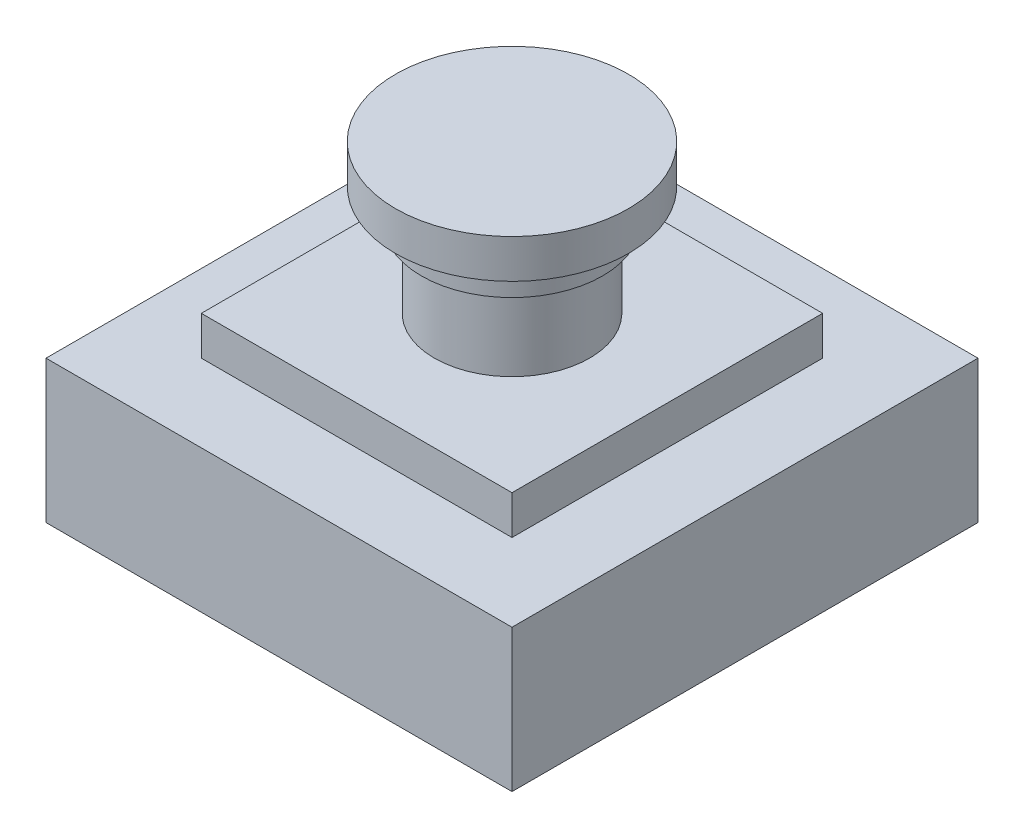
from build123d import *

# Parameters (mm, degrees)
SKETCH1_W           = 36
SKETCH1_H           = 36
BOSS_EXTRUDE1_DEPTH = 11
SKETCH2_W           = 24
SKETCH2_H           = 24
BOSS_EXTRUDE2_DEPTH = 3
SKETCH3_R           = 6
BOSS_EXTRUDE3_DEPTH = 6
SKETCH4_R           = 7
BOSS_EXTRUDE4_DEPTH = 2.5
SKETCH5_R           = 9
BOSS_EXTRUDE5_DEPTH = 3


with BuildPart() as part:
    # Sketch1 → Boss-Extrude1 (new body)
    with BuildSketch(Plane(origin=(0, 0, 0), x_dir=(1, 0, 0), z_dir=(0, 1, 0))):
        Rectangle(SKETCH1_W, SKETCH1_H)
    extrude(amount=BOSS_EXTRUDE1_DEPTH)

    # Sketch2 → Boss-Extrude2 (add)
    with BuildSketch(Plane(origin=(0, 11, 0), x_dir=(1, 0, 0), z_dir=(0, 1, 0))):
        Rectangle(SKETCH2_W, SKETCH2_H)
    extrude(amount=BOSS_EXTRUDE2_DEPTH)

    # Sketch3 → Boss-Extrude3 (add)
    with BuildSketch(Plane(origin=(0, 14, 0), x_dir=(1, 0, 0), z_dir=(0, 1, 0))):
        with Locations(Location((0, 0, 0), (0, 0, 270))):
            Circle(SKETCH3_R)
    extrude(amount=BOSS_EXTRUDE3_DEPTH)

    # Sketch4 → Boss-Extrude4 (add)
    with BuildSketch(Plane(origin=(0, 20, 0), x_dir=(1, 0, 0), z_dir=(0, 1, 0))):
        with Locations(Location((0, 0, 0), (0, 0, 270))):
            Circle(SKETCH4_R)
    extrude(amount=BOSS_EXTRUDE4_DEPTH)

    # Sketch5 → Boss-Extrude5 (add)
    with BuildSketch(Plane(origin=(0, 22.5, 0), x_dir=(1, 0, 0), z_dir=(0, 1, 0))):
        with Locations(Location((0, 0, 0), (0, 0, 270))):
            Circle(SKETCH5_R)
    extrude(amount=BOSS_EXTRUDE5_DEPTH)


solid = part.part
